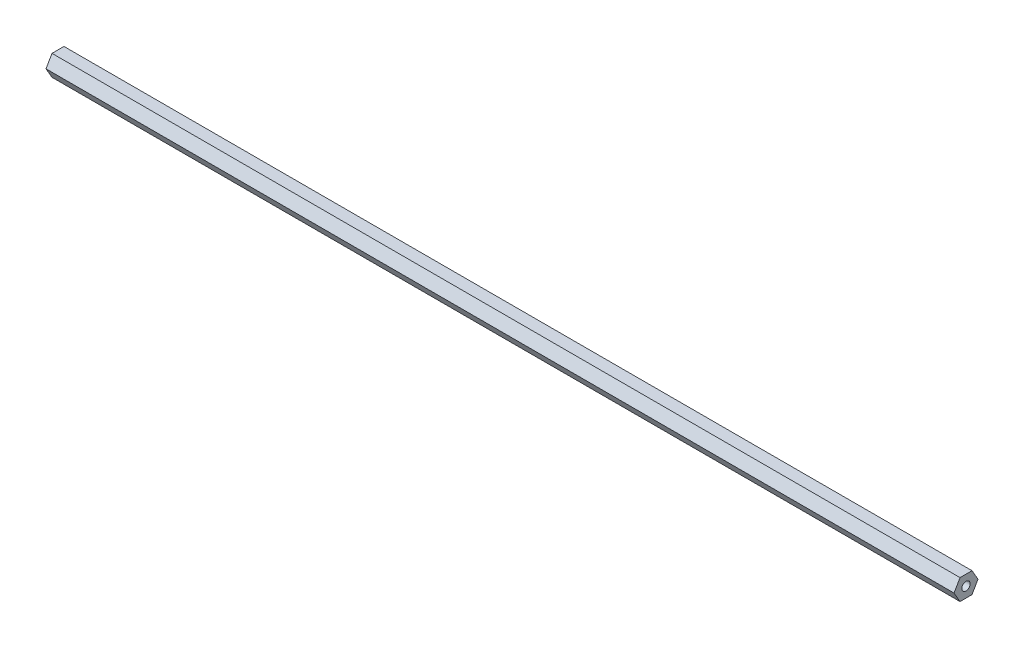
from build123d import *

# Parameters (mm, degrees)
BOSS_EXTRUDE1_DEPTH         = 555.625
F_1_4_20_TAPPED_HOLE1_D     = 5.1054
F_1_4_20_TAPPED_HOLE1_DEPTH = 16.51
F_1_4_20_TAPPED_HOLE1_TIP   = 1.533816902
F_1_4_20_TAPPED_HOLE2_D     = 5.1054
F_1_4_20_TAPPED_HOLE2_DEPTH = 16.51
F_1_4_20_TAPPED_HOLE2_TIP   = 1.533816902


with BuildPart() as part:
    # Sketch1 → Boss-Extrude1 (new body)
    with BuildSketch(Plane(origin=(0, 0, 0), x_dir=(0, 0, -1), z_dir=(1, 0, 0))):
        Polygon((7.332348419, 0), (3.666174209, 6.35), (-3.666174209, 6.35), (-7.332348419, 0), (-3.666174209, -6.35), (3.666174209, -6.35), align=None)
    extrude(amount=BOSS_EXTRUDE1_DEPTH)

    # 1/4-20 Tapped Hole1
    with Locations(Plane(origin=(555.625, 0, 0), x_dir=(0, 0, -1), z_dir=(1, 0, 0))):
        with Locations((0, 0)):
            Hole(F_1_4_20_TAPPED_HOLE1_D / 2, depth=F_1_4_20_TAPPED_HOLE1_DEPTH)
            with Locations((0, 0, -(F_1_4_20_TAPPED_HOLE1_DEPTH + F_1_4_20_TAPPED_HOLE1_TIP / 2))):  # 118° drill point
                Cone(0, F_1_4_20_TAPPED_HOLE1_D / 2, F_1_4_20_TAPPED_HOLE1_TIP, mode=Mode.SUBTRACT)

    # 1/4-20 Tapped Hole2
    with Locations(Plane.ZY):
        with Locations((0, 0)):
            Hole(F_1_4_20_TAPPED_HOLE2_D / 2, depth=F_1_4_20_TAPPED_HOLE2_DEPTH)
            with Locations((0, 0, -(F_1_4_20_TAPPED_HOLE2_DEPTH + F_1_4_20_TAPPED_HOLE2_TIP / 2))):  # 118° drill point
                Cone(0, F_1_4_20_TAPPED_HOLE2_D / 2, F_1_4_20_TAPPED_HOLE2_TIP, mode=Mode.SUBTRACT)


solid = part.part
